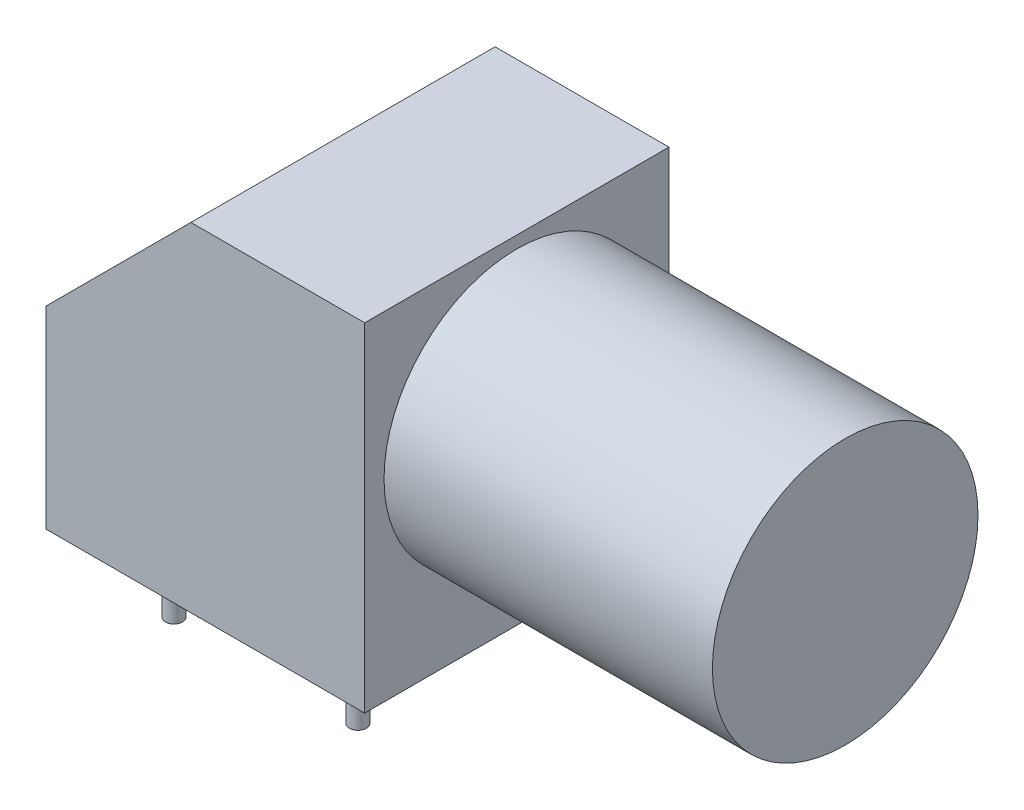
from build123d import *

# Parameters (mm, degrees)
ESQUISSE1_W      = 13.2
ESQUISSE1_H      = 12.6
EXTRUSION1_DEPTH = 14
CHANFREIN1_SIZE  = 6
ESQUISSE2_R      = 5.5
EXTRUSION2_DEPTH = 13.6
ESQUISSE3_R      = 0.35
EXTRUSION3_DEPTH = 3


with BuildPart() as part:
    # Esquisse1 → Extrusion1 (new body)
    with BuildSketch(Plane(origin=(0, 0, 0), x_dir=(1, 0, 0), z_dir=(0, 1, 0))):
        with Locations((6.6, 6.3)):
            Rectangle(ESQUISSE1_W, ESQUISSE1_H)
    extrude(amount=EXTRUSION1_DEPTH)

    # Chanfrein1
    chanfrein1_edges = [part.edges().sort_by_distance(p)[0] for p in [
        (0, 14, -6.3),
    ]]
    chamfer(chanfrein1_edges, length=CHANFREIN1_SIZE)

    # Esquisse2 → Extrusion2 (add)
    with BuildSketch(Plane(origin=(13.2, 0, 0), x_dir=(0, 0, -1), z_dir=(1, 0, 0))):
        with Locations(Location((6.3, 8, 0), (0, 0, 180))):
            Circle(ESQUISSE2_R)
    extrude(amount=EXTRUSION2_DEPTH)

    # Esquisse3 → Extrusion3 (add)
    with BuildSketch(Plane.XZ):
        with Locations(Location((10.43, -2.49, 0), (0, 0, 270))):
            Circle(ESQUISSE3_R)
        with Locations(Location((10.43, -10.11, 0), (0, 0, 270))):
            Circle(ESQUISSE3_R)
        with Locations(Location((2.81, -2.49, 0), (0, 0, 270))):
            Circle(ESQUISSE3_R)
        with Locations(Location((2.81, -10.11, 0), (0, 0, 270))):
            Circle(ESQUISSE3_R)
    extrude(amount=EXTRUSION3_DEPTH)


solid = part.part
